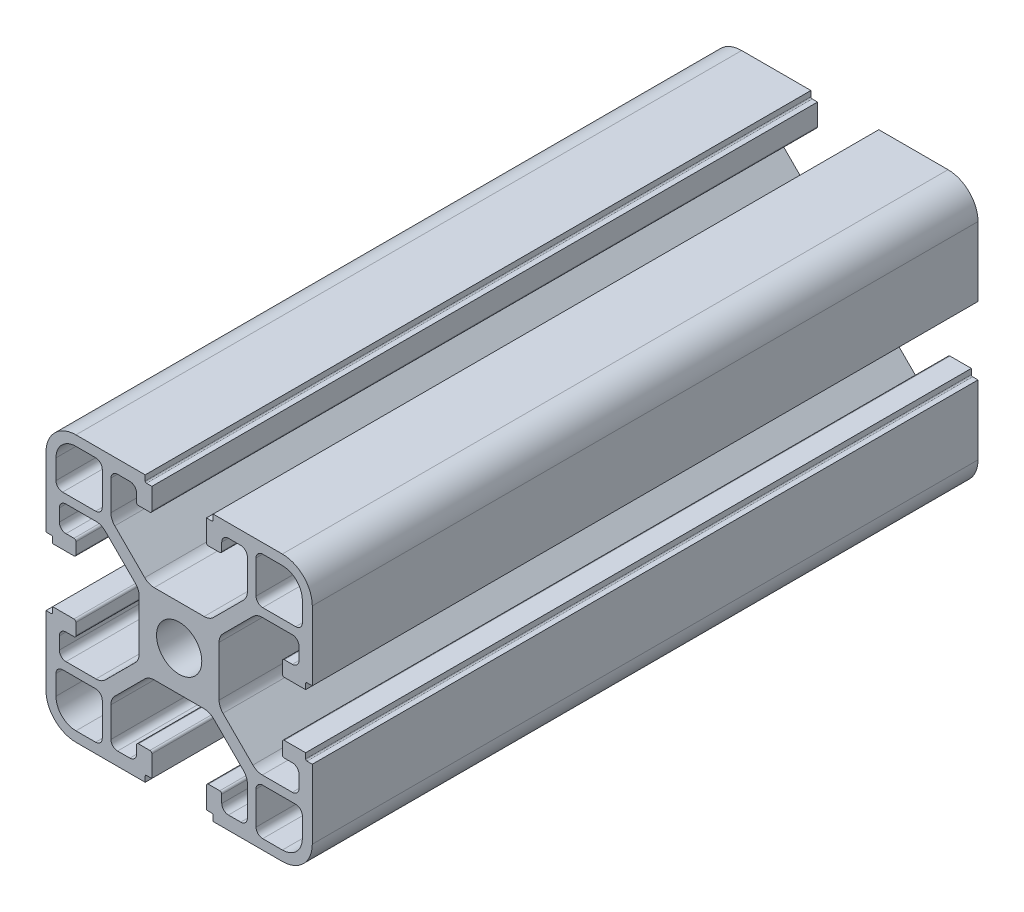
from build123d import *

# Parameters (mm, degrees)
SKETCH_1_R      = 3.4
EXTRUDE_1_DEPTH = 100


with BuildPart() as part:
    # 草图1 → 凸台-拉伸1 (new body)
    with BuildSketch(Plane.XY):
        with BuildLine():
            Line((-6.693625971, 20.445460798), (-17.093625971, 20.445460798))
            ThreePointArc((-17.093625971, 20.445460798), (-20.275606487, 19.127441313), (-21.593625971, 15.945460798))
            Line((-21.593625971, 15.945460798), (-21.593625971, 5.545460798))
            Line((-21.593625971, 5.545460798), (-20.793625971, 5.545460798))
            ThreePointArc((-20.793625971, 5.545460798), (-20.652204615, 5.486882154), (-20.593625971, 5.345460798))
            Line((-20.593625971, 5.345460798), (-20.593625971, 4.545460798))
            Line((-20.593625971, 4.545460798), (-17.393625971, 4.545460798))
            ThreePointArc((-17.393625971, 4.545460798), (-17.181493937, 4.633328763), (-17.093625971, 4.845460798))
            Line((-17.093625971, 4.845460798), (-17.093625971, 6.545460798))
            ThreePointArc((-17.093625971, 6.545460798), (-17.181493937, 6.757592832), (-17.393625971, 6.845460798))
            Line((-17.393625971, 6.845460798), (-18.593625971, 6.845460798))
            ThreePointArc((-18.593625971, 6.845460798), (-19.300732752, 7.138354017), (-19.593625971, 7.845460798))
            Line((-19.593625971, 7.845460798), (-19.593625971, 9.695460798))
            ThreePointArc((-19.593625971, 9.695460798), (-19.300732752, 10.402567579), (-18.593625971, 10.695460798))
            Line((-18.593625971, 10.695460798), (-14.086266658, 10.695460798))
            ThreePointArc((-14.086266658, 10.695460798), (-13.320899794, 10.543219863), (-12.672053096, 10.10967436))
            Line((-12.672053096, 10.10967436), (-8.179412409, 5.617033673))
            ThreePointArc((-8.179412409, 5.617033673), (-7.745866906, 4.968186975), (-7.593625971, 4.202820111))
            Line((-7.593625971, 4.202820111), (-7.593625971, -3.311898515))
            ThreePointArc((-7.593625971, -3.311898515), (-7.745866906, -4.07726538), (-8.179412409, -4.726112077))
            Line((-8.179412409, -4.726112077), (-12.672053096, -9.218752765))
            ThreePointArc((-12.672053096, -9.218752765), (-13.320899794, -9.652298267), (-14.086266658, -9.804539202))
            Line((-14.086266658, -9.804539202), (-18.593625971, -9.804539202))
            ThreePointArc((-18.593625971, -9.804539202), (-19.300732752, -9.511645983), (-19.593625971, -8.804539202))
            Line((-19.593625971, -8.804539202), (-19.593625971, -6.954539202))
            ThreePointArc((-19.593625971, -6.954539202), (-19.300732752, -6.247432421), (-18.593625971, -5.954539202))
            Line((-18.593625971, -5.954539202), (-17.393625971, -5.954539202))
            ThreePointArc((-17.393625971, -5.954539202), (-17.181493937, -5.866671237), (-17.093625971, -5.654539202))
            Line((-17.093625971, -5.654539202), (-17.093625971, -3.954539202))
            ThreePointArc((-17.093625971, -3.954539202), (-17.181493937, -3.742407168), (-17.393625971, -3.654539202))
            Line((-17.393625971, -3.654539202), (-20.593625971, -3.654539202))
            Line((-20.593625971, -3.654539202), (-20.593625971, -4.454539202))
            ThreePointArc((-20.593625971, -4.454539202), (-20.652204615, -4.595960558), (-20.793625971, -4.654539202))
            Line((-20.793625971, -4.654539202), (-21.593625971, -4.654539202))
            Line((-21.593625971, -4.654539202), (-21.593625971, -15.054539202))
            ThreePointArc((-21.593625971, -15.054539202), (-20.275606487, -18.236519718), (-17.093625971, -19.554539202))
            Line((-17.093625971, -19.554539202), (-6.693625971, -19.554539202))
            Line((-6.693625971, -19.554539202), (-6.693625971, -18.754539202))
            ThreePointArc((-6.693625971, -18.754539202), (-6.635047327, -18.613117846), (-6.493625971, -18.554539202))
            Line((-6.493625971, -18.554539202), (-5.693625971, -18.554539202))
            Line((-5.693625971, -18.554539202), (-5.693625971, -15.354539202))
            ThreePointArc((-5.693625971, -15.354539202), (-5.781493937, -15.142407168), (-5.993625971, -15.054539202))
            Line((-5.993625971, -15.054539202), (-7.693625971, -15.054539202))
            ThreePointArc((-7.693625971, -15.054539202), (-7.905758006, -15.142407168), (-7.993625971, -15.354539202))
            Line((-7.993625971, -15.354539202), (-7.993625971, -16.554539202))
            ThreePointArc((-7.993625971, -16.554539202), (-8.28651919, -17.261645983), (-8.993625971, -17.554539202))
            Line((-8.993625971, -17.554539202), (-10.843625971, -17.554539202))
            ThreePointArc((-10.843625971, -17.554539202), (-11.550732752, -17.261645983), (-11.843625971, -16.554539202))
            Line((-11.843625971, -16.554539202), (-11.843625971, -12.047179889))
            ThreePointArc((-11.843625971, -12.047179889), (-11.691385036, -11.281813025), (-11.257839534, -10.632966327))
            Line((-11.257839534, -10.632966327), (-6.765198846, -6.14032564))
            ThreePointArc((-6.765198846, -6.14032564), (-6.116352149, -5.706780137), (-5.350985284, -5.554539202))
            Line((-5.350985284, -5.554539202), (2.163733342, -5.554539202))
            ThreePointArc((2.163733342, -5.554539202), (2.929100206, -5.706780137), (3.577946904, -6.14032564))
            Line((3.577946904, -6.14032564), (8.070587591, -10.632966327))
            ThreePointArc((8.070587591, -10.632966327), (8.504133094, -11.281813025), (8.656374029, -12.047179889))
            Line((8.656374029, -12.047179889), (8.656374029, -16.554539202))
            ThreePointArc((8.656374029, -16.554539202), (8.36348081, -17.261645983), (7.656374029, -17.554539202))
            Line((7.656374029, -17.554539202), (5.806374029, -17.554539202))
            ThreePointArc((5.806374029, -17.554539202), (5.099267248, -17.261645983), (4.806374029, -16.554539202))
            Line((4.806374029, -16.554539202), (4.806374029, -15.354539202))
            ThreePointArc((4.806374029, -15.354539202), (4.718506063, -15.142407168), (4.506374029, -15.054539202))
            Line((4.506374029, -15.054539202), (2.806374029, -15.054539202))
            ThreePointArc((2.806374029, -15.054539202), (2.594241994, -15.142407168), (2.506374029, -15.354539202))
            Line((2.506374029, -15.354539202), (2.506374029, -18.554539202))
            Line((2.506374029, -18.554539202), (3.306374029, -18.554539202))
            ThreePointArc((3.306374029, -18.554539202), (3.447795385, -18.613117846), (3.506374029, -18.754539202))
            Line((3.506374029, -18.754539202), (3.506374029, -19.554539202))
            Line((3.506374029, -19.554539202), (13.906374029, -19.554539202))
            ThreePointArc((13.906374029, -19.554539202), (17.088354544, -18.236519718), (18.406374029, -15.054539202))
            Line((18.406374029, -15.054539202), (18.406374029, -4.654539202))
            Line((18.406374029, -4.654539202), (17.606374029, -4.654539202))
            ThreePointArc((17.606374029, -4.654539202), (17.464952673, -4.595960558), (17.406374029, -4.454539202))
            Line((17.406374029, -4.454539202), (17.406374029, -3.654539202))
            Line((17.406374029, -3.654539202), (14.206374029, -3.654539202))
            ThreePointArc((14.206374029, -3.654539202), (13.994241994, -3.742407168), (13.906374029, -3.954539202))
            Line((13.906374029, -3.954539202), (13.906374029, -5.654539202))
            ThreePointArc((13.906374029, -5.654539202), (13.994241994, -5.866671237), (14.206374029, -5.954539202))
            Line((14.206374029, -5.954539202), (15.406374029, -5.954539202))
            ThreePointArc((15.406374029, -5.954539202), (16.11348081, -6.247432421), (16.406374029, -6.954539202))
            Line((16.406374029, -6.954539202), (16.406374029, -8.804539202))
            ThreePointArc((16.406374029, -8.804539202), (16.11348081, -9.511645983), (15.406374029, -9.804539202))
            Line((15.406374029, -9.804539202), (10.899014716, -9.804539202))
            ThreePointArc((10.899014716, -9.804539202), (10.133647851, -9.652298267), (9.484801154, -9.218752765))
            Line((9.484801154, -9.218752765), (4.992160466, -4.726112077))
            ThreePointArc((4.992160466, -4.726112077), (4.558614964, -4.07726538), (4.406374029, -3.311898515))
            Line((4.406374029, -3.311898515), (4.406374029, 4.202820111))
            ThreePointArc((4.406374029, 4.202820111), (4.558614964, 4.968186975), (4.992160466, 5.617033673))
            Line((4.992160466, 5.617033673), (9.484801154, 10.10967436))
            ThreePointArc((9.484801154, 10.10967436), (10.133647851, 10.543219863), (10.899014716, 10.695460798))
            Line((10.899014716, 10.695460798), (15.406374029, 10.695460798))
            ThreePointArc((15.406374029, 10.695460798), (16.11348081, 10.402567579), (16.406374029, 9.695460798))
            Line((16.406374029, 9.695460798), (16.406374029, 7.845460798))
            ThreePointArc((16.406374029, 7.845460798), (16.11348081, 7.138354017), (15.406374029, 6.845460798))
            Line((15.406374029, 6.845460798), (14.206374029, 6.845460798))
            ThreePointArc((14.206374029, 6.845460798), (13.994241994, 6.757592832), (13.906374029, 6.545460798))
            Line((13.906374029, 6.545460798), (13.906374029, 4.845460798))
            ThreePointArc((13.906374029, 4.845460798), (13.994241994, 4.633328763), (14.206374029, 4.545460798))
            Line((14.206374029, 4.545460798), (17.406374029, 4.545460798))
            Line((17.406374029, 4.545460798), (17.406374029, 5.345460798))
            ThreePointArc((17.406374029, 5.345460798), (17.464952673, 5.486882154), (17.606374029, 5.545460798))
            Line((17.606374029, 5.545460798), (18.406374029, 5.545460798))
            Line((18.406374029, 5.545460798), (18.406374029, 15.945460798))
            ThreePointArc((18.406374029, 15.945460798), (17.088354544, 19.127441313), (13.906374029, 20.445460798))
            Line((13.906374029, 20.445460798), (3.506374029, 20.445460798))
            Line((3.506374029, 20.445460798), (3.506374029, 19.645460798))
            ThreePointArc((3.506374029, 19.645460798), (3.447795385, 19.504039442), (3.306374029, 19.445460798))
            Line((3.306374029, 19.445460798), (2.506374029, 19.445460798))
            Line((2.506374029, 19.445460798), (2.506374029, 16.245460798))
            ThreePointArc((2.506374029, 16.245460798), (2.594241994, 16.033328763), (2.806374029, 15.945460798))
            Line((2.806374029, 15.945460798), (4.506374029, 15.945460798))
            ThreePointArc((4.506374029, 15.945460798), (4.718506063, 16.033328763), (4.806374029, 16.245460798))
            Line((4.806374029, 16.245460798), (4.806374029, 17.445460798))
            ThreePointArc((4.806374029, 17.445460798), (5.099267248, 18.152567579), (5.806374029, 18.445460798))
            Line((5.806374029, 18.445460798), (7.656374029, 18.445460798))
            ThreePointArc((7.656374029, 18.445460798), (8.36348081, 18.152567579), (8.656374029, 17.445460798))
            Line((8.656374029, 17.445460798), (8.656374029, 12.938101485))
            ThreePointArc((8.656374029, 12.938101485), (8.504133094, 12.17273462), (8.070587591, 11.523887923))
            Line((8.070587591, 11.523887923), (3.577946904, 7.031247235))
            ThreePointArc((3.577946904, 7.031247235), (2.929100206, 6.597701733), (2.163733342, 6.445460798))
            Line((2.163733342, 6.445460798), (-5.350985284, 6.445460798))
            ThreePointArc((-5.350985284, 6.445460798), (-6.116352149, 6.597701733), (-6.765198846, 7.031247235))
            Line((-6.765198846, 7.031247235), (-11.257839534, 11.523887923))
            ThreePointArc((-11.257839534, 11.523887923), (-11.691385036, 12.17273462), (-11.843625971, 12.938101485))
            Line((-11.843625971, 12.938101485), (-11.843625971, 17.445460798))
            ThreePointArc((-11.843625971, 17.445460798), (-11.550732752, 18.152567579), (-10.843625971, 18.445460798))
            Line((-10.843625971, 18.445460798), (-8.993625971, 18.445460798))
            ThreePointArc((-8.993625971, 18.445460798), (-8.28651919, 18.152567579), (-7.993625971, 17.445460798))
            Line((-7.993625971, 17.445460798), (-7.993625971, 16.245460798))
            ThreePointArc((-7.993625971, 16.245460798), (-7.905758006, 16.033328763), (-7.693625971, 15.945460798))
            Line((-7.693625971, 15.945460798), (-5.993625971, 15.945460798))
            ThreePointArc((-5.993625971, 15.945460798), (-5.781493937, 16.033328763), (-5.693625971, 16.245460798))
            Line((-5.693625971, 16.245460798), (-5.693625971, 19.445460798))
            Line((-5.693625971, 19.445460798), (-6.493625971, 19.445460798))
            ThreePointArc((-6.493625971, 19.445460798), (-6.635047327, 19.504039442), (-6.693625971, 19.645460798))
            Line((-6.693625971, 19.645460798), (-6.693625971, 20.445460798))
        make_face()
        with Locations((-1.593625971, 0.445460798)):
            Circle(SKETCH_1_R, mode=Mode.SUBTRACT)
        with BuildLine():
            Line((-20.097625971, 15.949460798), (-20.097625971, 12.995460798))
            ThreePointArc((-20.097625971, 12.995460798), (-19.804732752, 12.288354017), (-19.097625971, 11.995460798))
            Line((-19.097625971, 11.995460798), (-14.143625971, 11.995460798))
            ThreePointArc((-14.143625971, 11.995460798), (-13.43651919, 12.288354017), (-13.143625971, 12.995460798))
            Line((-13.143625971, 12.995460798), (-13.143625971, 17.949460798))
            ThreePointArc((-13.143625971, 17.949460798), (-13.43651919, 18.656567579), (-14.143625971, 18.949460798))
            Line((-14.143625971, 18.949460798), (-17.097625971, 18.949460798))
            ThreePointArc((-17.097625971, 18.949460798), (-19.218946315, 18.070781141), (-20.097625971, 15.949460798))
        make_face(mode=Mode.SUBTRACT)
        with BuildLine():
            Line((16.910374029, 15.949460798), (16.910374029, 12.995460798))
            ThreePointArc((16.910374029, 12.995460798), (16.61748081, 12.288354017), (15.910374029, 11.995460798))
            Line((15.910374029, 11.995460798), (10.956374029, 11.995460798))
            ThreePointArc((10.956374029, 11.995460798), (10.249267248, 12.288354017), (9.956374029, 12.995460798))
            Line((9.956374029, 12.995460798), (9.956374029, 17.949460798))
            ThreePointArc((9.956374029, 17.949460798), (10.249267248, 18.656567579), (10.956374029, 18.949460798))
            Line((10.956374029, 18.949460798), (13.910374029, 18.949460798))
            ThreePointArc((13.910374029, 18.949460798), (16.031694372, 18.070781141), (16.910374029, 15.949460798))
        make_face(mode=Mode.SUBTRACT)
        with BuildLine():
            Line((-20.097625971, -15.058539202), (-20.097625971, -12.104539202))
            ThreePointArc((-20.097625971, -12.104539202), (-19.804732752, -11.397432421), (-19.097625971, -11.104539202))
            Line((-19.097625971, -11.104539202), (-14.143625971, -11.104539202))
            ThreePointArc((-14.143625971, -11.104539202), (-13.43651919, -11.397432421), (-13.143625971, -12.104539202))
            Line((-13.143625971, -12.104539202), (-13.143625971, -17.058539202))
            ThreePointArc((-13.143625971, -17.058539202), (-13.43651919, -17.765645983), (-14.143625971, -18.058539202))
            Line((-14.143625971, -18.058539202), (-17.097625971, -18.058539202))
            ThreePointArc((-17.097625971, -18.058539202), (-19.218946315, -17.179859546), (-20.097625971, -15.058539202))
        make_face(mode=Mode.SUBTRACT)
        with BuildLine():
            Line((16.910374029, -15.058539202), (16.910374029, -12.104539202))
            ThreePointArc((16.910374029, -12.104539202), (16.61748081, -11.397432421), (15.910374029, -11.104539202))
            Line((15.910374029, -11.104539202), (10.956374029, -11.104539202))
            ThreePointArc((10.956374029, -11.104539202), (10.249267248, -11.397432421), (9.956374029, -12.104539202))
            Line((9.956374029, -12.104539202), (9.956374029, -17.058539202))
            ThreePointArc((9.956374029, -17.058539202), (10.249267248, -17.765645983), (10.956374029, -18.058539202))
            Line((10.956374029, -18.058539202), (13.910374029, -18.058539202))
            ThreePointArc((13.910374029, -18.058539202), (16.031694372, -17.179859546), (16.910374029, -15.058539202))
        make_face(mode=Mode.SUBTRACT)
    extrude(amount=EXTRUDE_1_DEPTH)


solid = part.part
